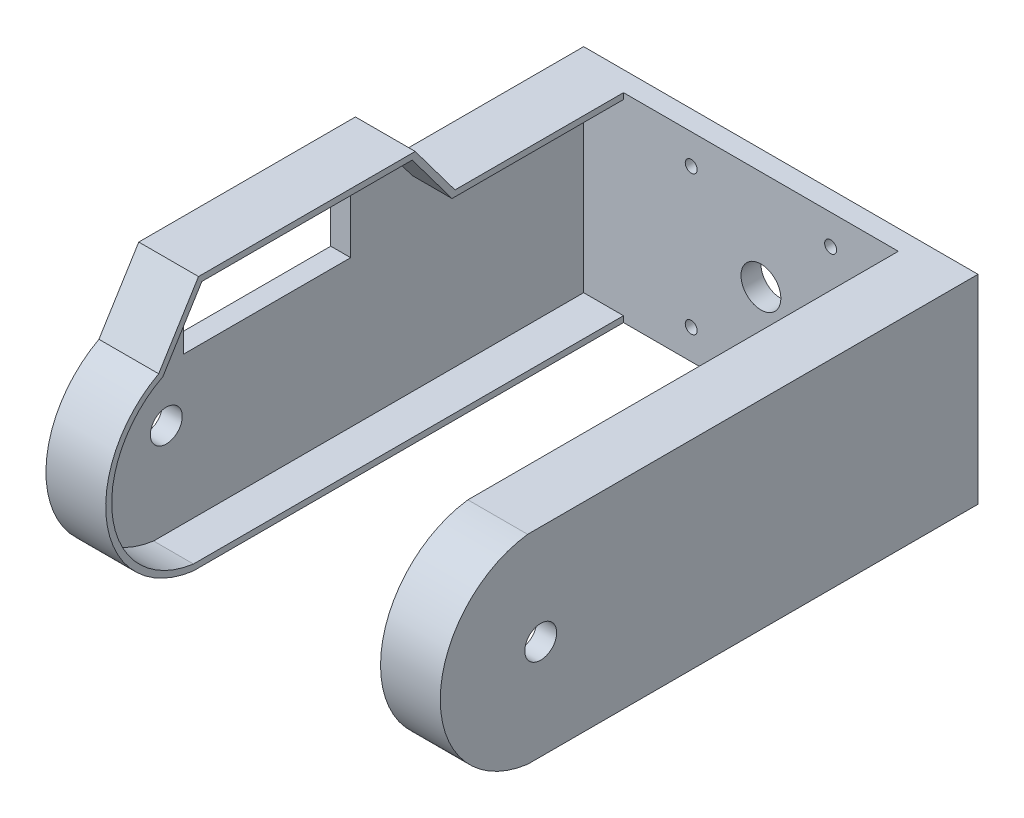
from build123d import *

# Parameters (mm, degrees)
SKETCH1_W           = 99
SKETCH1_H           = 50
BOSS_EXTRUDE1_DEPTH = 5
SKETCH2_W           = 5
SKETCH2_H           = 50
BOSS_EXTRUDE2_DEPTH = 130
SKETCH3_OUTSIDE_W   = 171.944
SKETCH3_OUTSIDE_H   = 86.944
SKETCH3_OUTSIDE_R   = 4
CUT_EXTRUDE1_DEPTH  = 170.266063
EXTRUDE_THIN2_DEPTH = 15
CUT_EXTRUDE3_REACH  = 171.266
SKETCH8_W           = 42.955183
SKETCH8_H           = 22
BOSS_EXTRUDE4_START = -5
BOSS_EXTRUDE4_DEPTH = 5
EXTRUDE_THIN3_START = -15
EXTRUDE_THIN3_DEPTH = 15
CUT_EXTRUDE5_REACH  = 150.819
SKETCH13_R          = 5
SKETCH5_R           = 1.5
CUT_EXTRUDE6_DEPTH  = 149.819085


with BuildPart() as part:
    # Sketch1 → Boss-Extrude1 (new body)
    with BuildSketch(Plane.XY):
        Rectangle(SKETCH1_W, SKETCH1_H)
    extrude(amount=BOSS_EXTRUDE1_DEPTH)

    # Sketch2 → Boss-Extrude2 (add)
    with BuildSketch(Plane.XY.offset(5)):
        with Locations((47, 0)):
            Rectangle(SKETCH2_W, SKETCH2_H)
        with Locations((-47, 0)):
            Rectangle(SKETCH2_W, SKETCH2_H)
    extrude(amount=BOSS_EXTRUDE2_DEPTH)

    # Sketch3 outside → Cut-Extrude1 (cut, through all)
    # profile 1 of 2: a face of its own
    with BuildSketch(Plane(origin=(49.5, 0, 0), x_dir=(0, 0, -1), z_dir=(1, 0, 0))):
        with Locations((-67.5, 0)):
            Rectangle(SKETCH3_OUTSIDE_W, SKETCH3_OUTSIDE_H)
        with BuildLine():
            Line((0, -25), (0, 25))
            Line((0, 25), (-106.5, 25))
            ThreePointArc((-106.5, 25), (-135, 0), (-106.5, -25))
            Line((-106.5, -25), (0, -25))
        make_face(mode=Mode.SUBTRACT)
    # profile 2 of 2: a face of its own
    with BuildSketch(Plane(origin=(49.5, 0, 0), x_dir=(0, 0, -1), z_dir=(1, 0, 0))):
        with Locations((-109.785088, 0)):
            Circle(SKETCH3_OUTSIDE_R)
    extrude(amount=-CUT_EXTRUDE1_DEPTH, mode=Mode.SUBTRACT)

    # Sketch7 → Extrude-Thin2 (add)
    with BuildSketch(Plane(origin=(49.5, 0, 0), x_dir=(0, 0, -1), z_dir=(1, 0, 0))):
        with BuildLine():
            Line((-113.070175, -25), (0, -25))
            Line((0, -25), (0, 25))
            Line((0, 25), (-113.070175, 25))
            ThreePointArc((-113.070175, 25), (-135, 0), (-113.070175, -25))
        make_face()
        with BuildLine():
            Line((-112.970533, -23.5), (-1.5, -23.5))
            Line((-1.5, -23.5), (-1.5, 23.5))
            Line((-1.5, 23.5), (-112.970533, 23.5))
            ThreePointArc((-112.970533, 23.5), (-133.5, 0), (-112.970533, -23.5))
        make_face(mode=Mode.SUBTRACT)
    extrude(amount=-EXTRUDE_THIN2_DEPTH)

    # Sketch8 → Cut-Extrude3 (cut, up to next)
    with BuildSketch(Plane.ZY.offset(49.5), mode=Mode.PRIVATE) as cut_extrude3_sk1:
        with Locations((84.477591, 24.364958)):
            Rectangle(SKETCH8_W, SKETCH8_H)
    cut_extrude3_tool1 = extrude(cut_extrude3_sk1.sketch, amount=-CUT_EXTRUDE3_REACH, mode=Mode.PRIVATE) & part.part
    add(cut_extrude3_tool1.solids().sort_by_distance((-49.5, 24.364958, 84.477592))[0], mode=Mode.SUBTRACT)

    # Sketch9 → Boss-Extrude4 (add)
    with BuildSketch(Plane.ZY.offset(49.5).offset(BOSS_EXTRUDE4_START)):
        with BuildLine():
            Line((121.7, 22.222211), (111.7, 38.364958))
            Line((111.7, 38.364958), (105.455183, 38.364958))
            Line((105.455183, 38.364958), (63.5, 38.364958))
            Line((63.5, 38.364958), (57.3, 38.364958))
            Line((57.3, 38.364958), (47.3, 25))
            Line((47.3, 25), (59.748378, 25))
            Line((59.748378, 25), (63, 25))
            Line((63, 25), (63, 13.364958))
            Line((63, 13.364958), (63.5, 13.364958))
            Line((63.5, 13.364958), (63.5, 35.320141))
            Line((63.5, 35.320141), (105.455183, 35.320141))
            Line((105.455183, 35.320141), (105.455183, 13.364958))
            Line((105.455183, 13.364958), (105.955183, 13.364958))
            Line((105.955183, 13.364958), (105.955183, 25))
            Line((105.955183, 25), (113.070175, 25))
            ThreePointArc((113.070175, 25), (117.510955, 24.002141), (121.7, 22.222211))
        make_face()
    extrude(amount=BOSS_EXTRUDE4_DEPTH)

    # Sketch12 → Extrude-Thin3 (add)
    with BuildSketch(Plane.ZY.offset(49.5).offset(EXTRUDE_THIN3_START)):
        with BuildLine():
            Line((121.7, 22.222211), (111.7, 38.364958))
            Line((111.7, 38.364958), (57.3, 38.364958))
            Line((57.3, 38.364958), (47.3, 25))
            Line((47.3, 25), (0, 25))
            Line((0, 25), (0, -25))
            Line((0, -25), (113.070175, -25))
            ThreePointArc((113.070175, -25), (134.589206, -4.532935), (121.7, 22.222211))
        make_face()
        with BuildLine():
            Line((120.640171, 21.084692), (110.864718, 36.864958))
            Line((110.864718, 36.864958), (58.051066, 36.864958))
            Line((58.051066, 36.864958), (48.051066, 23.5))
            Line((48.051066, 23.5), (1.5, 23.5))
            Line((1.5, 23.5), (1.5, -23.5))
            Line((1.5, -23.5), (112.970533, -23.5))
            ThreePointArc((112.970533, -23.5), (133.156712, -4.020481), (120.640171, 21.084692))
        make_face(mode=Mode.SUBTRACT)
    extrude(amount=EXTRUDE_THIN3_DEPTH)

    # Sketch13 → Cut-Extrude5 (cut, up to next)
    with BuildSketch(Plane(origin=(0, 0, 0), x_dir=(-1, 0, 0), z_dir=(0, 0, -1)), mode=Mode.PRIVATE) as cut_extrude5_sk1:
        Circle(SKETCH13_R)
    cut_extrude5_tool1 = extrude(cut_extrude5_sk1.sketch, amount=-CUT_EXTRUDE5_REACH, mode=Mode.PRIVATE) & part.part
    add(cut_extrude5_tool1.solids().sort_by_distance((0, 0, 0))[0], mode=Mode.SUBTRACT)

    # Sketch5 → Cut-Extrude6 (cut, through all)
    with BuildSketch(Plane(origin=(0, 0, 0), x_dir=(-1, 0, 0), z_dir=(0, 0, -1))):
        with Locations((17.5, 17.5)):
            Circle(SKETCH5_R)
        with Locations((17.5, -17.5)):
            Circle(SKETCH5_R)
        with Locations((-17.5, -17.5)):
            Circle(SKETCH5_R)
        with Locations((-17.5, 17.5)):
            Circle(SKETCH5_R)
    extrude(amount=-CUT_EXTRUDE6_DEPTH, mode=Mode.SUBTRACT)


solid = part.part
